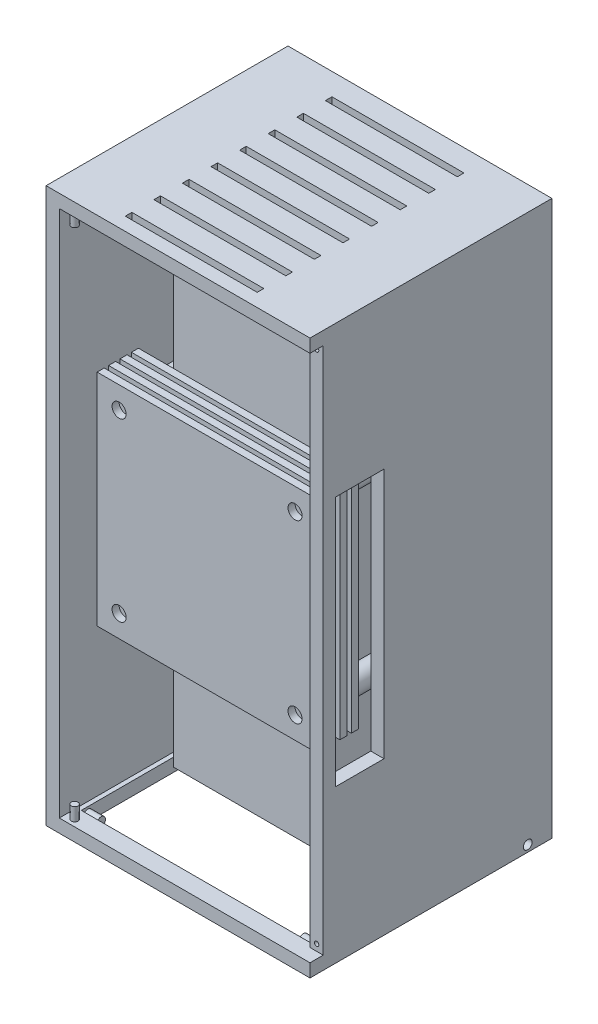
from build123d import *

# Parameters (mm, degrees)
SKETCH_1_W           = 50
SKETCH_1_H           = 50
EXTRUDE_1_DEPTH      = 1.6
SKETCH_4_W           = 50
SKETCH_4_H           = 50
EXTRUDE_3_DEPTH      = 1.6
SKETCH_5_W           = 50
SKETCH_5_H           = 50
EXTRUDE_4_DEPTH      = 1.6
SKETCH_6_W           = 50
SKETCH_6_H           = 50
EXTRUDE_5_DEPTH      = 1.6
SKETCH_9_W           = 34
SKETCH_9_H           = 107
EXTRUDE_6_DEPTH      = 34
FILLET_12_R          = 3
FILLET_13_R          = 3
SKETCH_10_R          = 1.6
CUT_EXTRUDE_1_DEPTH  = 10
SKETCH_17_W          = 54
SKETCH_17_H          = 120
EXTRUDE_8_DEPTH      = 3
SKETCH_18_R          = 15
EXTRUDE_10_DEPTH     = 1
SKETCH_19_R          = 4.530357101
EXTRUDE_11_DEPTH     = 3
SKETCH_22_R          = 2.5
SKETCH_22_R_2        = 2
EXTRUDE_12_DEPTH     = 37
SKETCH_23_R          = 1.6
CUT_EXTRUDE_2_DEPTH  = 3
SKETCH_24_W          = 60
SKETCH_24_H          = 126
SKETCH_24_W_2        = 54
SKETCH_24_H_2        = 120
EXTRUDE_14_DEPTH     = 55
SKETCH_31_W          = 30
SKETCH_31_H          = 1.5
CUT_EXTRUDE_4_DEPTH  = 4
SKETCH_32_R          = 1
CUT_EXTRUDE_5_DEPTH  = 10
SKETCH_33_W          = 54
SKETCH_33_H          = 3
EXTRUDE_15_DEPTH     = 121
SKETCH_34_W          = 52
SKETCH_34_H          = 47
CUT_EXTRUDE_6_DEPTH  = 3
SKETCH_36_R          = 1
EXTRUDE_16_DEPTH     = 58
SKETCH_37_R          = 1
CUT_EXTRUDE_8_DEPTH  = 46
SKETCH_38_R          = 1
CUT_EXTRUDE_9_DEPTH  = 100
SKETCH_39_W          = 11.072615153
SKETCH_39_H          = 57.029921058
CUT_EXTRUDE_10_DEPTH = 3
SKETCH_28_W          = 57
SKETCH_28_H          = 120
CUT_EXTRUDE_11_DEPTH = 3
SKETCH_30_R          = 0.75
EXTRUDE_17_DEPTH     = 3
SKETCH_29_R          = 0.75
EXTRUDE_18_DEPTH     = 3
SKETCH_41_R          = 0.5
CUT_EXTRUDE_12_DEPTH = 1
SKETCH_42_W          = 20
SKETCH_42_H          = 5
EXTRUDE_19_DEPTH     = 6


with BuildPart() as part:
    # 草图1 → 凸台-拉伸1 (new body)
    with BuildSketch(Plane.XY):
        with Locations((25, -25)):
            Rectangle(SKETCH_1_W, SKETCH_1_H)
    extrude(amount=EXTRUDE_1_DEPTH)


with BuildPart() as body_2:
    # 草图4 → 凸台-拉伸3 (new body)
    with BuildSketch(Plane(origin=(0, 0, -1), x_dir=(-1, 0, 0), z_dir=(0, 0, -1))):
        with Locations((-25, -25)):
            Rectangle(SKETCH_4_W, SKETCH_4_H)
    extrude(amount=EXTRUDE_3_DEPTH)


with BuildPart() as body_3:
    # 草图5 → 凸台-拉伸4 (new body)
    with BuildSketch(Plane(origin=(0, 0, -3.6), x_dir=(-1, 0, 0), z_dir=(0, 0, -1))):
        with Locations((-25, -25)):
            Rectangle(SKETCH_5_W, SKETCH_5_H)
    extrude(amount=EXTRUDE_4_DEPTH)


with BuildPart() as body_4:
    # 草图6 → 凸台-拉伸5 (new body)
    with BuildSketch(Plane(origin=(0, 0, -6.2), x_dir=(-1, 0, 0), z_dir=(0, 0, -1))):
        with Locations((-25, -25)):
            Rectangle(SKETCH_6_W, SKETCH_6_H)
    extrude(amount=EXTRUDE_5_DEPTH)

    # 草图9 → 凸台-拉伸6 (add)
    with BuildSketch(Plane(origin=(0, 0, -7.8), x_dir=(-1, 0, 0), z_dir=(0, 0, -1))):
        with Locations((-25, -25)):
            Rectangle(SKETCH_9_W, SKETCH_9_H)
    extrude(amount=EXTRUDE_6_DEPTH)

    # 圆角12
    fillet_12_edges = [body_4.edges().sort_by_distance(p)[0] for p in [
        (8, -25, -41.8),
    ]]
    fillet(fillet_12_edges, radius=FILLET_12_R)

    # 圆角13
    fillet_13_edges = [body_4.edges().sort_by_distance(p)[0] for p in [
        (42, -25, -41.8),
    ]]
    fillet(fillet_13_edges, radius=FILLET_13_R)


with BuildPart() as cut_extrude_1_tool:
    # 草图10 → 切除-拉伸1 (new body)
    with BuildSketch(Plane.XY.offset(1.6)):
        with Locations((5, -5)):
            Circle(SKETCH_10_R)
        with Locations((45, -5)):
            Circle(SKETCH_10_R)
        with Locations((5, -45)):
            Circle(SKETCH_10_R)
        with Locations((45, -45)):
            Circle(SKETCH_10_R)
    extrude(amount=-CUT_EXTRUDE_1_DEPTH)


with BuildPart() as part_1:
    add(part.part)

    # 切除-拉伸1: cut by cut_extrude_1_tool
    add(cut_extrude_1_tool.part, mode=Mode.SUBTRACT)


with BuildPart() as body_2_1:
    add(body_2.part)

    # 切除-拉伸1: cut by cut_extrude_1_tool
    add(cut_extrude_1_tool.part, mode=Mode.SUBTRACT)


with BuildPart() as body_3_1:
    add(body_3.part)

    # 切除-拉伸1: cut by cut_extrude_1_tool
    add(cut_extrude_1_tool.part, mode=Mode.SUBTRACT)


with BuildPart() as body_4_1:
    add(body_4.part)

    # 切除-拉伸1: cut by cut_extrude_1_tool
    add(cut_extrude_1_tool.part, mode=Mode.SUBTRACT)

    # 草图18 → 凸台-拉伸10 (add)
    with BuildSketch(Plane(origin=(0, -78.5, 0), x_dir=(-1, 0, 0), z_dir=(0, -1, 0))):
        with Locations(Location((-25.067497088, 24.38867284, 0), (0, 0, 90))):
            Circle(SKETCH_18_R)
    extrude(amount=EXTRUDE_10_DEPTH)

    # 草图19 → 凸台-拉伸11 (add)
    with BuildSketch(Plane(origin=(0, -79.5, 0), x_dir=(-1, 0, 0), z_dir=(0, -1, 0))):
        with Locations(Location((-25.607473795, 24.3, 0), (0, 0, 90))):
            Circle(SKETCH_19_R)
    extrude(amount=EXTRUDE_11_DEPTH)



with BuildPart() as body_5:
    # 草图17 → 凸台-拉伸8 (new body)
    with BuildSketch(Plane(origin=(0, 0, -43.8), x_dir=(-1, 0, 0), z_dir=(0, 0, -1))):
        with Locations((-25, -25.5)):
            Rectangle(SKETCH_17_W, SKETCH_17_H)
    extrude(amount=EXTRUDE_8_DEPTH)


with BuildPart() as body_4_2:
    add(body_4_1.part)

    add(body_5.part)  # 凸台-拉伸12 merges body 5
    # 草图22 → 凸台-拉伸12 (add)
    with BuildSketch(Plane(origin=(0, 0, -7.8), x_dir=(-1, 0, 0), z_dir=(0, 0, -1))):
        with Locations(Location((-45, -45, 0), (0, 0, 180))):
            Circle(SKETCH_22_R)
        with Locations(Location((-45, -5, 0), (0, 0, 180))):
            Circle(SKETCH_22_R_2)
        with Locations(Location((-5, -45, 0), (0, 0, 180))):
            Circle(SKETCH_22_R)
        with Locations(Location((-5, -5, 0), (0, 0, 180))):
            Circle(SKETCH_22_R)
    extrude(amount=EXTRUDE_12_DEPTH)

    # 草图23 → 切除-拉伸2 (cut)
    with BuildSketch(Plane.XY.offset(-7.8)):
        with Locations((45, -45)):
            Circle(SKETCH_23_R)
        with Locations((45, -5)):
            Circle(SKETCH_23_R)
        with Locations((5, -5)):
            Circle(SKETCH_23_R)
        with Locations((5, -45)):
            Circle(SKETCH_23_R)
    extrude(amount=-CUT_EXTRUDE_2_DEPTH, mode=Mode.SUBTRACT)

    # 草图24 → 凸台-拉伸14 (add)
    with BuildSketch(Plane(origin=(0, 0, -46.8), x_dir=(-1, 0, 0), z_dir=(0, 0, -1))):
        with Locations((-25, -25.5)):
            Rectangle(SKETCH_24_W, SKETCH_24_H)
        with Locations((-25, -25.5)):
            Rectangle(SKETCH_24_W_2, SKETCH_24_H_2, mode=Mode.SUBTRACT)
    extrude(amount=-EXTRUDE_14_DEPTH)

    # 草图31 → 切除-拉伸4 (cut)
    with BuildSketch(Plane(origin=(0, 37.5, 0), x_dir=(1, 0, 0), z_dir=(0, 1, 0))):
        with Locations((25, 41.05)):
            Rectangle(SKETCH_31_W, SKETCH_31_H)
        with Locations((25, 34.55)):
            Rectangle(SKETCH_31_W, SKETCH_31_H)
        with Locations((25, 28.05)):
            Rectangle(SKETCH_31_W, SKETCH_31_H)
        with Locations((25, 21.55)):
            Rectangle(SKETCH_31_W, SKETCH_31_H)
        with Locations((25, 15.05)):
            Rectangle(SKETCH_31_W, SKETCH_31_H)
        with Locations((25, 8.55)):
            Rectangle(SKETCH_31_W, SKETCH_31_H)
        with Locations((25, 2.05)):
            Rectangle(SKETCH_31_W, SKETCH_31_H)
        with Locations((25, -4.45)):
            Rectangle(SKETCH_31_W, SKETCH_31_H)
    extrude(amount=-CUT_EXTRUDE_4_DEPTH, mode=Mode.SUBTRACT)

    # 草图32 → 切除-拉伸5 (cut)
    with BuildSketch(Plane.XY.offset(-43.8)):
        with Locations((2, 30.5)):
            Circle(SKETCH_32_R)
        with Locations((48, 30.5)):
            Circle(SKETCH_32_R)
        with Locations((2, -81.5)):
            Circle(SKETCH_32_R)
        with Locations((48, -81.5)):
            Circle(SKETCH_32_R)
    extrude(amount=-CUT_EXTRUDE_5_DEPTH, mode=Mode.SUBTRACT)

    # 草图33 → 凸台-拉伸15 (add)
    with BuildSketch(Plane(origin=(0, -85.5, 0), x_dir=(1, 0, 0), z_dir=(0, 1, 0))):
        with Locations((25, -6.7)):
            Rectangle(SKETCH_33_W, SKETCH_33_H)
    extrude(amount=EXTRUDE_15_DEPTH)

    # 草图34 → 切除-拉伸6 (cut)
    with BuildSketch(Plane(origin=(0, -88.5, 0), x_dir=(-1, 0, 0), z_dir=(0, -1, 0))):
        with Locations((-25, 19.3)):
            Rectangle(SKETCH_34_W, SKETCH_34_H)
    extrude(amount=-CUT_EXTRUDE_6_DEPTH, mode=Mode.SUBTRACT)

    # 草图36 → 凸台-拉伸16 (add)
    with BuildSketch(Plane(origin=(55, 0, 0), x_dir=(0, 0, -1), z_dir=(1, 0, 0))):
        with Locations((-2.7, -87)):
            Circle(SKETCH_36_R)
    extrude(amount=-EXTRUDE_16_DEPTH)

    # 草图37 → 切除-拉伸8 (cut)
    with BuildSketch(Plane.ZY.offset(-48)):
        with Locations(Location((2.7, -87, 0), (0, 0, 180))):
            Circle(SKETCH_37_R)
    extrude(amount=CUT_EXTRUDE_8_DEPTH, mode=Mode.SUBTRACT)

    # 草图38 → 切除-拉伸9 (cut)
    with BuildSketch(Plane(origin=(55, 0, 0), x_dir=(0, 0, -1), z_dir=(1, 0, 0))):
        with Locations(Location((41.3, -87, 0), (0, 0, 90))):
            Circle(SKETCH_38_R)
    extrude(amount=-CUT_EXTRUDE_9_DEPTH, mode=Mode.SUBTRACT)

    # 草图39 → 切除-拉伸10 (cut)
    with BuildSketch(Plane(origin=(55, 0, 0), x_dir=(0, 0, -1), z_dir=(1, 0, 0))):
        with Locations((3.08802192, -25.226211524)):
            Rectangle(SKETCH_39_W, SKETCH_39_H)
    extrude(amount=-CUT_EXTRUDE_10_DEPTH, mode=Mode.SUBTRACT)

    # 草图28 → 切除-拉伸11 (cut)
    with BuildSketch(Plane.XY.offset(8.2)):
        with Locations((26.5, -25.5)):
            Rectangle(SKETCH_28_W, SKETCH_28_H)
    extrude(amount=-CUT_EXTRUDE_11_DEPTH, mode=Mode.SUBTRACT)

    # 草图30 → 凸台-拉伸17 (add)
    with BuildSketch(Plane(origin=(0, 34.5, 0), x_dir=(-1, 0, 0), z_dir=(0, -1, 0))):
        with Locations(Location((0, -6.7, 0), (0, 0, 270))):
            Circle(SKETCH_30_R)
    extrude(amount=EXTRUDE_17_DEPTH)

    # 草图29 → 凸台-拉伸18 (add)
    with BuildSketch(Plane(origin=(0, -85.5, 0), x_dir=(1, 0, 0), z_dir=(0, 1, 0))):
        with Locations(Location((0, -6.7, 0), (0, 0, 270))):
            Circle(SKETCH_29_R)
    extrude(amount=EXTRUDE_18_DEPTH)

    # 草图41 → 切除-拉伸12 (cut)
    with BuildSketch(Plane.XY.offset(5.2)):
        with Locations((53.5, 33)):
            Circle(SKETCH_41_R)
        with Locations((53.5, -84)):
            Circle(SKETCH_41_R)
    extrude(amount=-CUT_EXTRUDE_12_DEPTH, mode=Mode.SUBTRACT)

    # 草图42 → 凸台-拉伸19 (add)
    with BuildSketch(Plane(origin=(0, 34.5, 0), x_dir=(-1, 0, 0), z_dir=(0, -1, 0))):
        with Locations((-24.5, 37.8)):
            Rectangle(SKETCH_42_W, SKETCH_42_H)
        with Locations((-24.5, 18.3)):
            Rectangle(SKETCH_42_W, SKETCH_42_H)
    extrude(amount=EXTRUDE_19_DEPTH)


solid = Compound([part_1.part, body_2_1.part, body_3_1.part, body_4_2.part])
